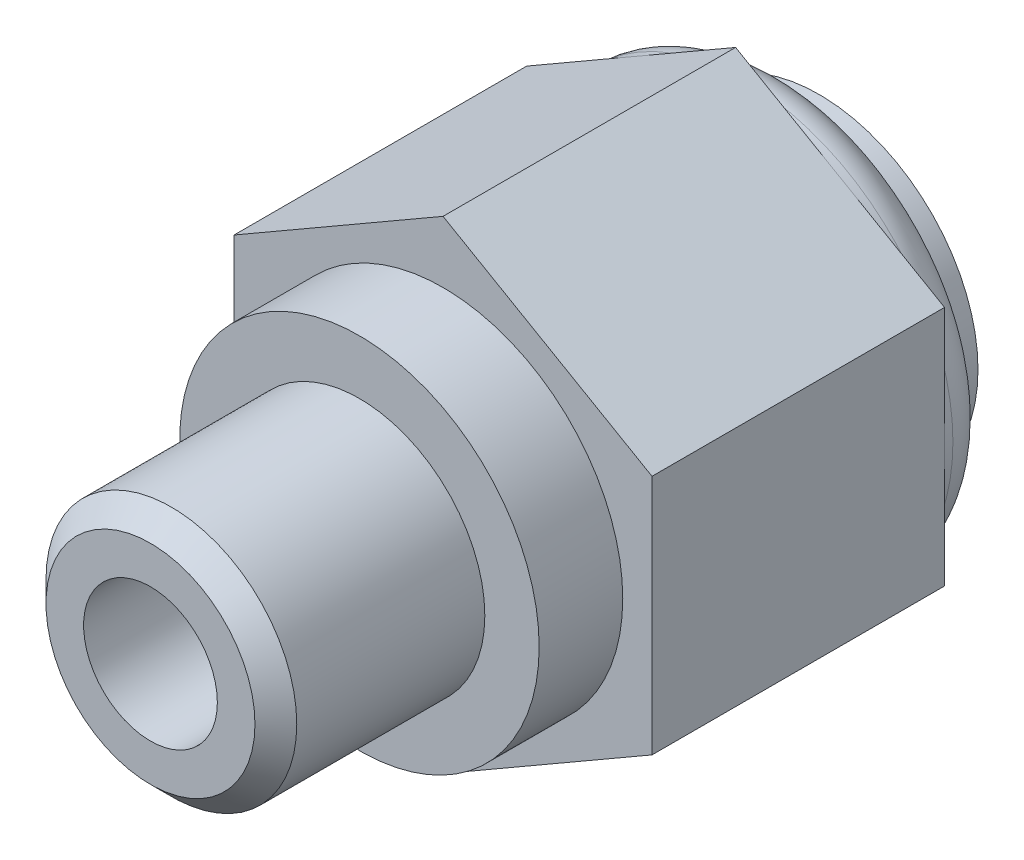
from build123d import *

# Parameters (mm, degrees)
EXTRUDE_2_DEPTH      = 7
SKETCH_1_4_R         = 5
EXTRUDE_3_DEPTH      = 1.2
SKETCH_1_5_R         = 3
EXTRUDE_4_DEPTH      = 14
SKETCH_1_6_R         = 4.3
EXTRUDE_5_DEPTH      = 9
SKETCH_1_8_R         = 3.8
EXTRUDE_6_DEPTH      = 2
FILLET_1_R           = 1
CUT_EXTRUDE_START    = -2
SKETCH_1_10_R        = 1.6
CUT_EXTRUDE_31_DEPTH = 18.947831619
SKETCH_1_11_R        = 3
CUT_EXTRUDE_32_DEPTH = 7
CHAMFER_1_SIZE       = 0.5


with BuildPart() as part:
    # Эскиз1 → Бобышка-Вытянуть2 (new body)
    with BuildSketch(Plane.XY):
        Polygon((0, 5.773502692), (-5, 2.886751346), (-5, -2.886751346), (0, -5.773502692), (5, -2.886751346), (5, 2.886751346), align=None)
    extrude(amount=EXTRUDE_2_DEPTH)

    # Эскиз1<4> → Бобышка-Вытянуть3 (add)
    with BuildSketch(Plane.XY):
        Circle(SKETCH_1_4_R)
    extrude(amount=-EXTRUDE_3_DEPTH)

    # Эскиз1<5> → Бобышка-Вытянуть4 (add)
    with BuildSketch(Plane.XY):
        Circle(SKETCH_1_5_R)
    extrude(amount=EXTRUDE_4_DEPTH)

    # Эскиз1<6> → Бобышка-Вытянуть5 (add)
    with BuildSketch(Plane.XY):
        Circle(SKETCH_1_6_R)
    extrude(amount=EXTRUDE_5_DEPTH)

    # Эскиз1<8> → Бобышка-Вытянуть6 (add)
    with BuildSketch(Plane.XY):
        Circle(SKETCH_1_8_R)
    extrude(amount=-EXTRUDE_6_DEPTH)

    # Скругление1
    fillet_1_edges = [part.edges().sort_by_distance(p)[0] for p in [
        (-5, 0, -1.2),
    ]]
    fillet(fillet_1_edges, radius=FILLET_1_R)

    # Эскиз1<10> → Вырез-Вытянуть31 (cut, through all)
    with BuildSketch(Plane.XY.offset(CUT_EXTRUDE_START)):
        Circle(SKETCH_1_10_R)
    extrude(amount=CUT_EXTRUDE_31_DEPTH, mode=Mode.SUBTRACT)

    # Эскиз1<11> → Вырез-Вытянуть32 (cut)
    with BuildSketch(Plane.XY.offset(CUT_EXTRUDE_START)):
        Circle(SKETCH_1_11_R)
    extrude(amount=CUT_EXTRUDE_32_DEPTH, mode=Mode.SUBTRACT)

    # Фаска1
    chamfer_1_edges = [part.edges().sort_by_distance(p)[0] for p in [
        (-3, 0, 14),
    ]]
    chamfer(chamfer_1_edges, length=CHAMFER_1_SIZE)


solid = part.part
